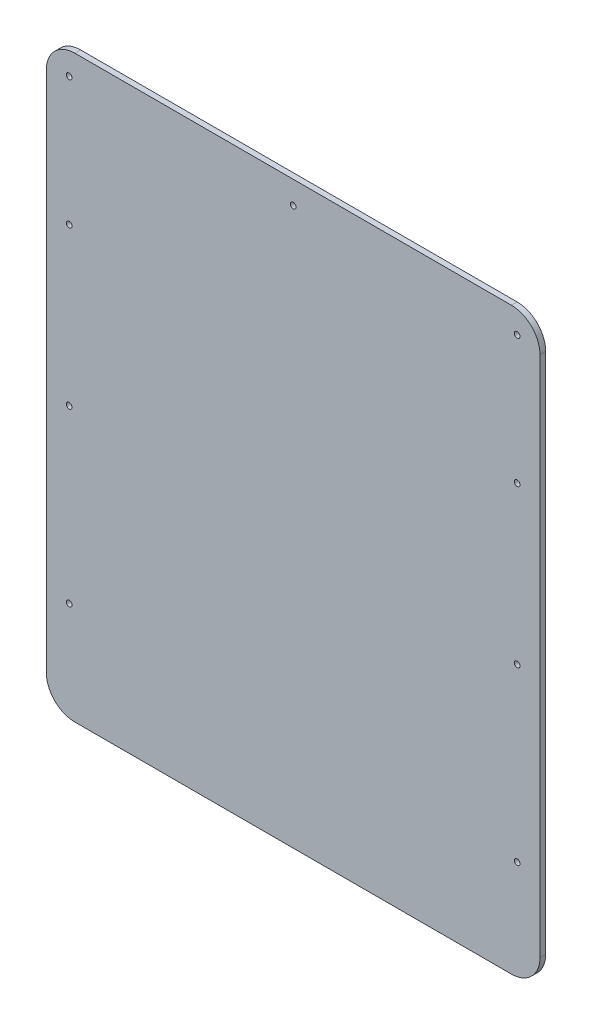
from build123d import *

# Parameters (mm, degrees)
SKETCH1_R           = 2
BOSS_EXTRUDE1_DEPTH = 4


with BuildPart() as part:
    # Sketch1 → Boss-Extrude1 (new body)
    with BuildSketch(Plane.XY):
        with BuildLine():
            Line((-153, 203), (153, 203))
            ThreePointArc((153, 203), (167.142135624, 197.142135624), (173, 183))
            Line((173, 183), (173, -183))
            ThreePointArc((173, -183), (167.142135624, -197.142135624), (153, -203))
            Line((153, -203), (-153, -203))
            ThreePointArc((-153, -203), (-167.142135624, -197.142135624), (-173, -183))
            Line((-173, -183), (-173, 183))
            ThreePointArc((-173, 183), (-167.142135624, 197.142135624), (-153, 203))
        make_face()
        with Locations((-157, 187)):
            Circle(SKETCH1_R, mode=Mode.SUBTRACT)
        with Locations((-157, 97)):
            Circle(SKETCH1_R, mode=Mode.SUBTRACT)
        with Locations((-157, -13)):
            Circle(SKETCH1_R, mode=Mode.SUBTRACT)
        with Locations((-157, -133)):
            Circle(SKETCH1_R, mode=Mode.SUBTRACT)
        with Locations((157, -133)):
            Circle(SKETCH1_R, mode=Mode.SUBTRACT)
        with Locations((157, -13)):
            Circle(SKETCH1_R, mode=Mode.SUBTRACT)
        with Locations((157, 97)):
            Circle(SKETCH1_R, mode=Mode.SUBTRACT)
        with Locations((157, 187)):
            Circle(SKETCH1_R, mode=Mode.SUBTRACT)
        with Locations((0, 187)):
            Circle(SKETCH1_R, mode=Mode.SUBTRACT)
    extrude(amount=BOSS_EXTRUDE1_DEPTH)


solid = part.part
